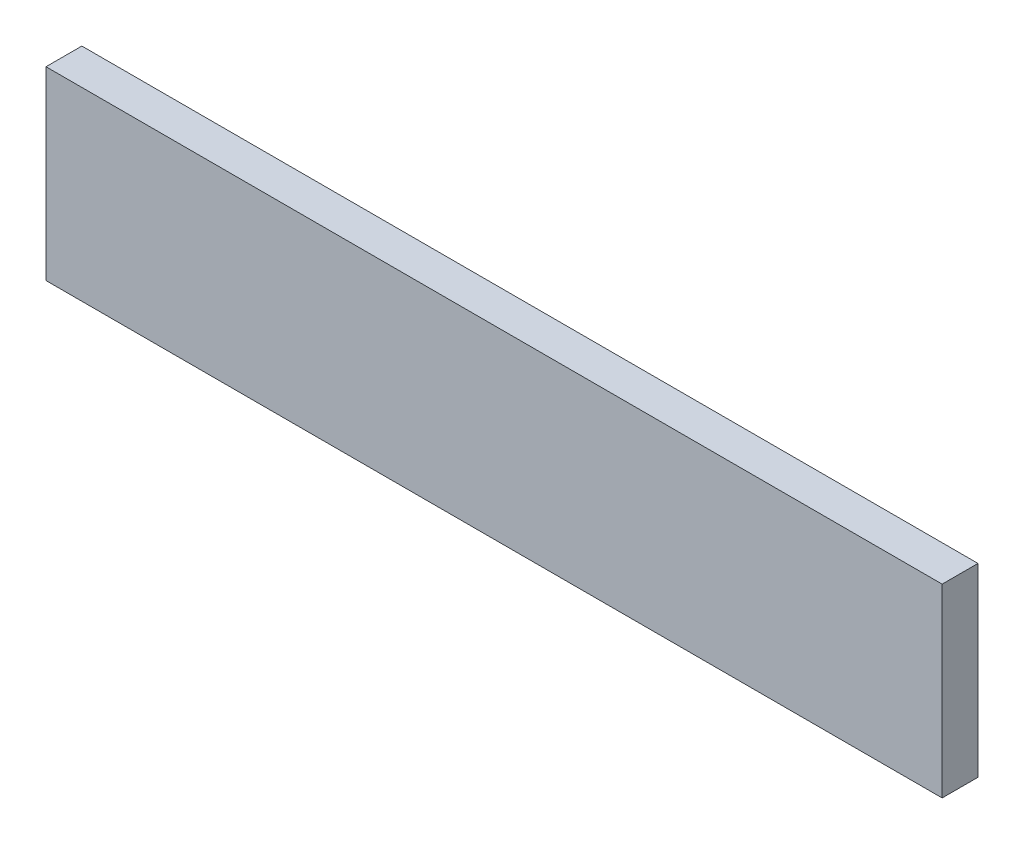
from build123d import *

# Parameters (mm, degrees)
SKETCH1_W           = 150
SKETCH1_H           = 31
BOSS_EXTRUDE1_DEPTH = 6


with BuildPart() as part:
    # Sketch1 → Boss-Extrude1 (new body)
    with BuildSketch(Plane.XY):
        with Locations((-932.415730337, 44.634831461)):
            Rectangle(SKETCH1_W, SKETCH1_H)
    extrude(amount=BOSS_EXTRUDE1_DEPTH)


solid = part.part
